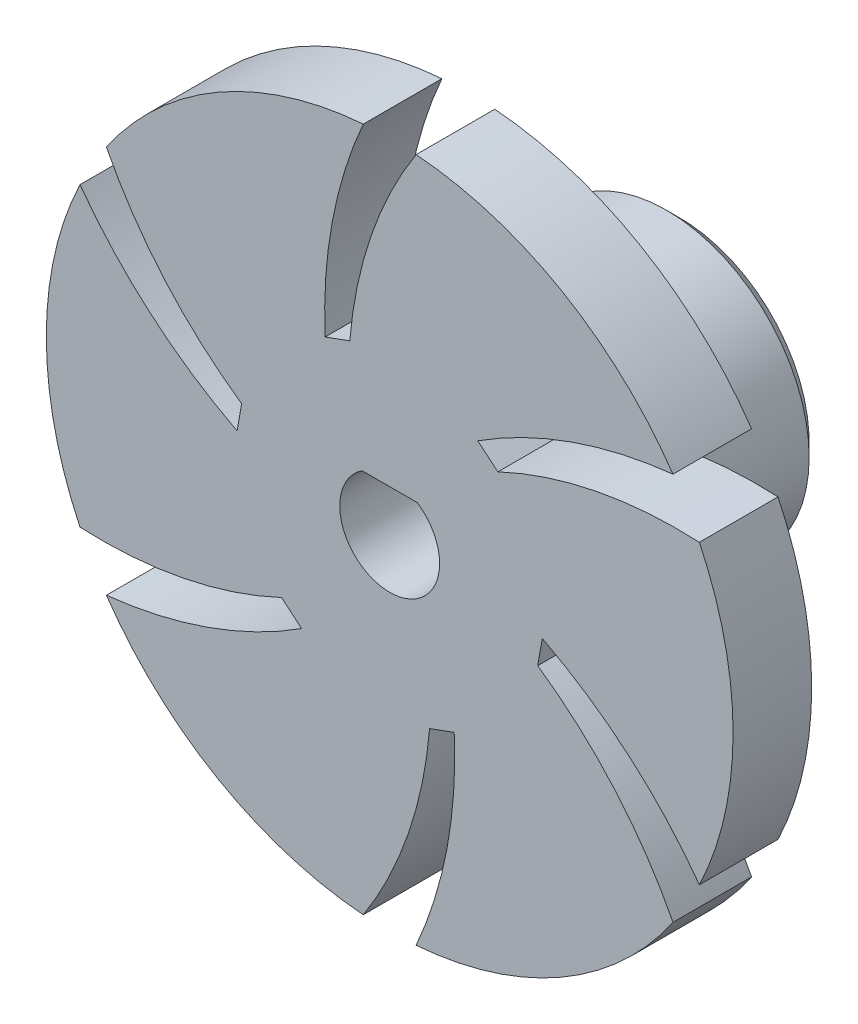
from build123d import *

# Parameters (mm, degrees)
SKETCH1_R           = 20.6375
BOSS_EXTRUDE1_DEPTH = 2.3622
CUT_EXTRUDE1_DEPTH  = 30.565736383
SKETCH4_R           = 8.5725
BOSS_EXTRUDE2_DEPTH = 12.7
CIRPATTERN1_COUNT   = 6
CUT_EXTRUDE2_DEPTH  = 34.954416084
CHAMFER1_SIZE       = 0.7874


with BuildPart() as part:
    # Sketch1 → Boss-Extrude1 (new, symmetric)
    with BuildSketch(Plane.XY):
        Circle(SKETCH1_R)
    extrude(amount=BOSS_EXTRUDE1_DEPTH, both=True)

    # Sketch2 → Cut-Extrude1 (cut, through all)
    with BuildSketch(Plane.XY.offset(2.3622)):
        with BuildLine():
            Line((-2.397761805, 8.89), (-3.877589744, 8.351386678))
            ThreePointArc((-3.877589744, 8.351386678), (-3.446754472, 14.597661325), (-1.5875, 20.576351717))
            ThreePointArc((-1.5875, 20.576351717), (0, 20.6375), (1.5875, 20.576351717))
            ThreePointArc((1.5875, 20.576351717), (-1.12604651, 14.979021398), (-2.397761805, 8.89))
        make_face()
    cut_extrude1 = extrude(amount=-CUT_EXTRUDE1_DEPTH, mode=Mode.SUBTRACT)

    # Sketch4 → Boss-Extrude2 (add)
    with BuildSketch(Plane(origin=(0, 0, -2.3622), x_dir=(-1, 0, 0), z_dir=(0, 0, -1))):
        with Locations(Location((0, 0, 0), (0, 0, 180))):
            Circle(SKETCH4_R)
    extrude(amount=BOSS_EXTRUDE2_DEPTH)

    # CirPattern1: Cut-Extrude1 ×6 about axis
    cirpattern1_axis = Axis((0, 0, 0), (0, 0, 1))
    for i in range(1, CIRPATTERN1_COUNT):
        add(cut_extrude1.rotate(cirpattern1_axis, i * 360 / CIRPATTERN1_COUNT), mode=Mode.SUBTRACT)

    # Sketch3 → Cut-Extrude2 (cut, through all)
    with BuildSketch(Plane.XY.offset(2.3622)):
        with BuildLine():
            Line((-1.658312395, 2.5), (1.658312395, 2.5))
            ThreePointArc((1.658312395, 2.5), (0, -3), (-1.658312395, 2.5))
        make_face()
    extrude(amount=-CUT_EXTRUDE2_DEPTH, mode=Mode.SUBTRACT)

    # Chamfer1
    chamfer1_edges = [part.edges().sort_by_distance(p)[0] for p in [
        (-8.5725, 0, -15.0622),
    ]]
    chamfer(chamfer1_edges, length=CHAMFER1_SIZE)


solid = part.part
